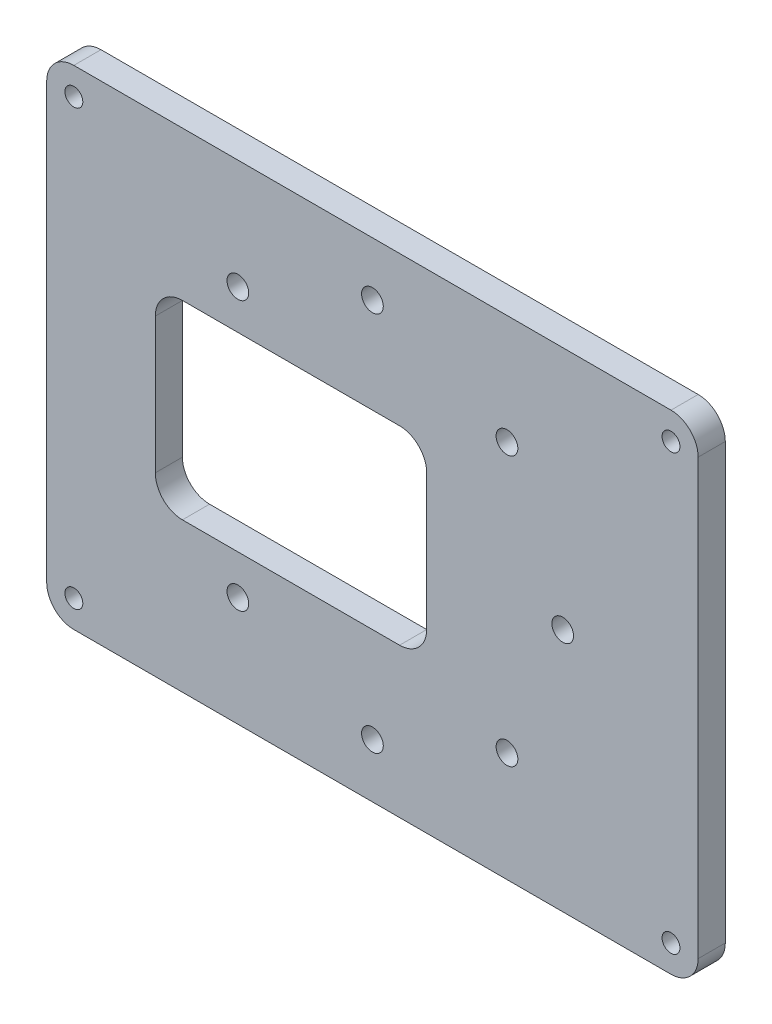
from build123d import *

# Parameters (mm, degrees)
SKETCH_1_W      = 120
SKETCH_1_H      = 90
SKETCH_1_R      = 1.65
SKETCH_1_R_2    = 2
SKETCH_1_W_2    = 50
SKETCH_1_H_2    = 35
EXTRUDE_1_DEPTH = 5
FILLET_1_R      = 5
FILLET_2_R      = 5


with BuildPart() as part:
    # 草图1 → 凸台-拉伸1 (new body)
    with BuildSketch(Plane.XY):
        with Locations((-60, -45)):
            Rectangle(SKETCH_1_W, SKETCH_1_H)
        with Locations((-115, -85)):
            Circle(SKETCH_1_R, mode=Mode.SUBTRACT)
        with Locations((-5, -85)):
            Circle(SKETCH_1_R, mode=Mode.SUBTRACT)
        with Locations((-5, -5)):
            Circle(SKETCH_1_R, mode=Mode.SUBTRACT)
        with Locations((-115, -5)):
            Circle(SKETCH_1_R, mode=Mode.SUBTRACT)
        with Locations((-24.95, -45)):
            Circle(SKETCH_1_R_2, mode=Mode.SUBTRACT)
        with Locations((-35.215907319, -69.784092681)):
            Circle(SKETCH_1_R_2, mode=Mode.SUBTRACT)
        with Locations((-60, -80.05)):
            Circle(SKETCH_1_R_2, mode=Mode.SUBTRACT)
        with Locations((-84.784092681, -69.784092681)):
            Circle(SKETCH_1_R_2, mode=Mode.SUBTRACT)
        with Locations((-84.784092681, -20.215907319)):
            Circle(SKETCH_1_R_2, mode=Mode.SUBTRACT)
        with Locations((-60, -9.95)):
            Circle(SKETCH_1_R_2, mode=Mode.SUBTRACT)
        with Locations((-35.215907319, -20.215907319)):
            Circle(SKETCH_1_R_2, mode=Mode.SUBTRACT)
        with Locations((-75, -45)):
            Rectangle(SKETCH_1_W_2, SKETCH_1_H_2, mode=Mode.SUBTRACT)
    extrude(amount=EXTRUDE_1_DEPTH)

    # 圆角1
    fillet_1_edges = [part.edges().sort_by_distance(p)[0] for p in [
        (0, -90, 2.5),
        (-120, -90, 2.5),
        (-120, 0, 2.5),
        (0, 0, 2.5),
    ]]
    fillet(fillet_1_edges, radius=FILLET_1_R)

    # 圆角2
    fillet_2_edges = [part.edges().sort_by_distance(p)[0] for p in [
        (-100, -27.5, 2.5),
        (-100, -62.5, 2.5),
        (-50, -62.5, 2.5),
        (-50, -27.5, 2.5),
    ]]
    fillet(fillet_2_edges, radius=FILLET_2_R)


solid = part.part
